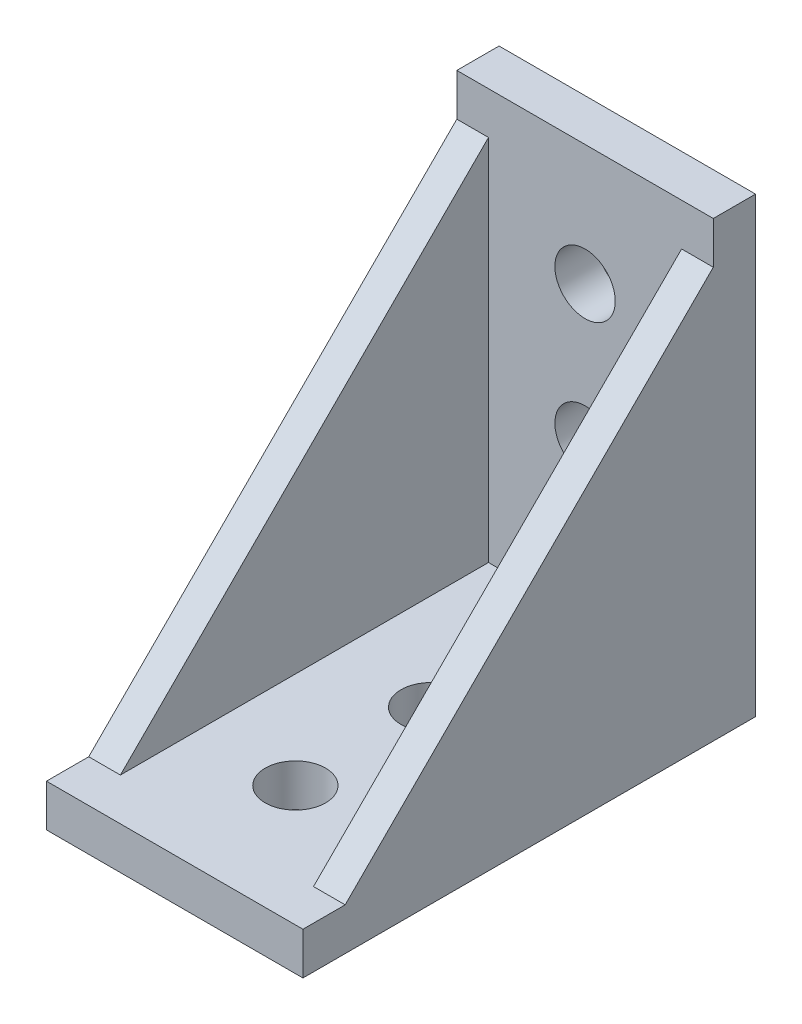
from build123d import *

# Parameters (mm, degrees)
EXTRUDE_1_DEPTH     = 17
CUT_EXTRUDE_START   = 30
SKETCH_2_W          = 12.8
SKETCH_2_H          = 24.4
CUT_EXTRUDE_1_DEPTH = 27.2
CUT_EXTRUDE_2_REACH = 47.706
SKETCH_3_R          = 2
CUT_EXTRUDE_3_REACH = 47.706
SKETCH_4_R          = 2


with BuildPart() as part:
    # 草图1 → 凸台-拉伸1 (new body)
    with BuildSketch(Plane(origin=(0, 0, 0), x_dir=(0, 0, -1), z_dir=(1, 0, 0))):
        Polygon((0, 0), (-30, 0), (-30, 2.8), (-27.2, 2.8), (-2.8, 27.2), (-2.8, 30), (0, 30), align=None)
    extrude(amount=EXTRUDE_1_DEPTH)

    # 草图2 → 切除-拉伸1 (cut)
    with BuildSketch(Plane(origin=(0, 0, 0), x_dir=(1, 0, 0), z_dir=(0, 1, 0)).offset(CUT_EXTRUDE_START)):
        with Locations((8.5, -15)):
            Rectangle(SKETCH_2_W, SKETCH_2_H)
    extrude(amount=-CUT_EXTRUDE_1_DEPTH, mode=Mode.SUBTRACT)

    # 草图3 → 切除-拉伸2 (cut, up to next)
    with BuildSketch(Plane(origin=(0, 0, 0), x_dir=(1, 0, 0), z_dir=(0, 1, 0)), mode=Mode.PRIVATE) as cut_extrude_2_sk1:
        with Locations(Location((8.5, -22, 0), (0, 0, 90))):
            Circle(SKETCH_3_R)
    cut_extrude_2_tool1 = extrude(cut_extrude_2_sk1.sketch, amount=CUT_EXTRUDE_2_REACH, mode=Mode.PRIVATE) & part.part
    # 草图3 → 切除-拉伸2 (cut, up to next)
    with BuildSketch(Plane(origin=(0, 0, 0), x_dir=(1, 0, 0), z_dir=(0, 1, 0)), mode=Mode.PRIVATE) as cut_extrude_2_sk2:
        with Locations(Location((8.5, -13, 0), (0, 0, 90))):
            Circle(SKETCH_3_R)
    cut_extrude_2_tool2 = extrude(cut_extrude_2_sk2.sketch, amount=CUT_EXTRUDE_2_REACH, mode=Mode.PRIVATE) & part.part
    add(cut_extrude_2_tool1.solids().sort_by_distance((8.5, 0, 22))[0], mode=Mode.SUBTRACT)
    add(cut_extrude_2_tool2.solids().sort_by_distance((8.5, 0, 13))[0], mode=Mode.SUBTRACT)

    # 草图4 → 切除-拉伸3 (cut, up to next)
    with BuildSketch(Plane.XY, mode=Mode.PRIVATE) as cut_extrude_3_sk1:
        with Locations(Location((8.5, 22, 0), (0, 0, 90))):
            Circle(SKETCH_4_R)
    cut_extrude_3_tool1 = extrude(cut_extrude_3_sk1.sketch, amount=CUT_EXTRUDE_3_REACH, mode=Mode.PRIVATE) & part.part
    # 草图4 → 切除-拉伸3 (cut, up to next)
    with BuildSketch(Plane.XY, mode=Mode.PRIVATE) as cut_extrude_3_sk2:
        with Locations(Location((8.5, 13, 0), (0, 0, 90))):
            Circle(SKETCH_4_R)
    cut_extrude_3_tool2 = extrude(cut_extrude_3_sk2.sketch, amount=CUT_EXTRUDE_3_REACH, mode=Mode.PRIVATE) & part.part
    add(cut_extrude_3_tool1.solids().sort_by_distance((8.5, 22, 0))[0], mode=Mode.SUBTRACT)
    add(cut_extrude_3_tool2.solids().sort_by_distance((8.5, 13, 0))[0], mode=Mode.SUBTRACT)


solid = part.part
